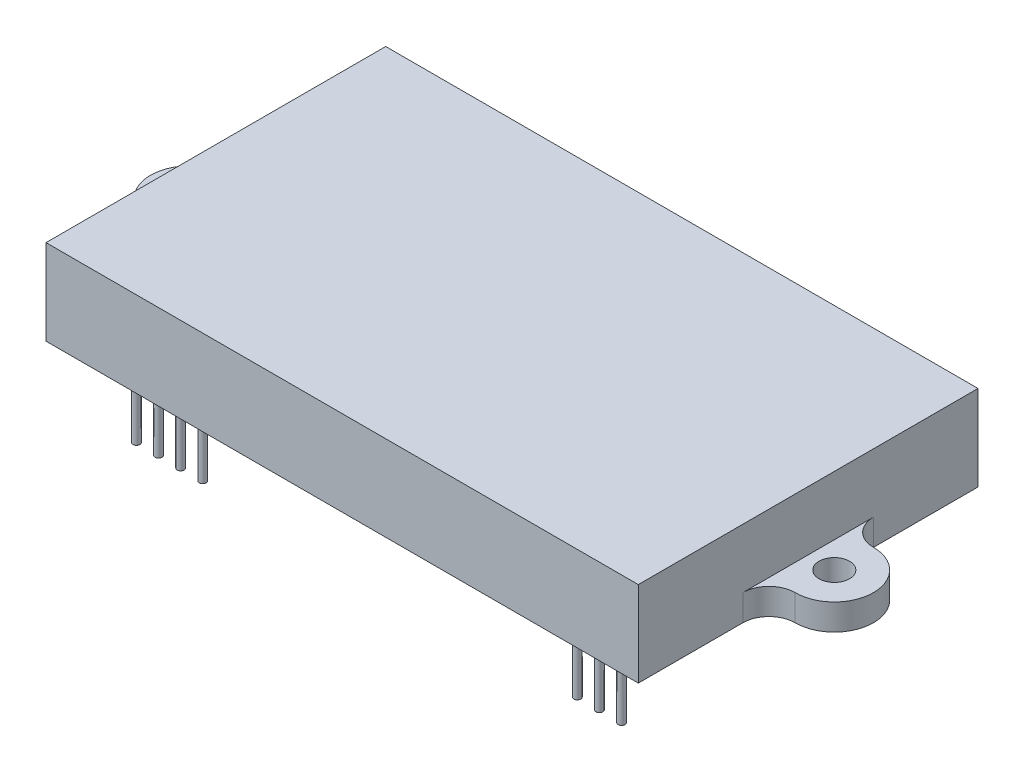
from build123d import *

# Parameters (mm, degrees)
ESQUISSE1_W        = 68
ESQUISSE1_H        = 39
BOSS_EXTRU_3_DEPTH = 9.8
ESQUISSE5_R        = 1.75
BOSS_EXTRU_5_DEPTH = 3
ESQUISSE6_R        = 1.75
BOSS_EXTRU_6_DEPTH = 3
ESQUISSE7_R        = 0.4
BOSS_EXTRU_7_DEPTH = 8.9
CONG_1_R           = 0.02


with BuildPart() as part:
    # Esquisse1 → Boss.-Extru.3 (new body)
    with BuildSketch(Plane(origin=(0, 0, 0), x_dir=(1, 0, 0), z_dir=(0, 1, 0))):
        with Locations((34, 19.5)):
            Rectangle(ESQUISSE1_W, ESQUISSE1_H)
    extrude(amount=BOSS_EXTRU_3_DEPTH)

    # Esquisse5 → Boss.-Extru.5 (add)
    with BuildSketch(Plane(origin=(0, 0, 0), x_dir=(1, 0, 0), z_dir=(0, 1, 0))):
        with BuildLine():
            Line((0, 27), (0, 12))
            ThreePointArc((0, 12), (-0.878679656, 14.121320344), (-3, 15))
            ThreePointArc((-3, 15), (-7.5, 19.5), (-3, 24))
            ThreePointArc((-3, 24), (-0.878679656, 24.878679656), (0, 27))
        make_face()
        with Locations(Location((-3, 19.5, 0), (0, 0, 270))):
            Circle(ESQUISSE5_R, mode=Mode.SUBTRACT)
    extrude(amount=BOSS_EXTRU_5_DEPTH)

    # Esquisse6 → Boss.-Extru.6 (add)
    with BuildSketch(Plane(origin=(0, 0, 0), x_dir=(1, 0, 0), z_dir=(0, 1, 0))):
        with BuildLine():
            Line((68, 12), (68, 27))
            ThreePointArc((68, 27), (68.878679656, 24.878679656), (71, 24))
            ThreePointArc((71, 24), (75.5, 19.5), (71, 15))
            ThreePointArc((71, 15), (68.878679656, 14.121320344), (68, 12))
        make_face()
        with Locations(Location((71, 19.5, 0), (0, 0, 270))):
            Circle(ESQUISSE6_R, mode=Mode.SUBTRACT)
    extrude(amount=BOSS_EXTRU_6_DEPTH)

    # Esquisse7 → Boss.-Extru.7 (add)
    with BuildSketch(Plane(origin=(0, 0, 0), x_dir=(1, 0, 0), z_dir=(0, 1, 0))):
        with Locations(Location((14, 4, 0), (0, 0, 270))):
            Circle(ESQUISSE7_R)
        with Locations(Location((11.46, 4, 0), (0, 0, 270))):
            Circle(ESQUISSE7_R)
        with Locations(Location((8.92, 4, 0), (0, 0, 270))):
            Circle(ESQUISSE7_R)
        with Locations(Location((6.38, 4, 0), (0, 0, 270))):
            Circle(ESQUISSE7_R)
        with Locations(Location((57, 4, 0), (0, 0, 270))):
            Circle(ESQUISSE7_R)
        with Locations(Location((59.54, 4, 0), (0, 0, 270))):
            Circle(ESQUISSE7_R)
        with Locations(Location((62.08, 4, 0), (0, 0, 270))):
            Circle(ESQUISSE7_R)
    extrude(amount=-BOSS_EXTRU_7_DEPTH)

    # Congé1
    cong_1_edges = [part.edges().sort_by_distance(p)[0] for p in [
        (14, -8.9, -4.4),
        (57, -8.9, -4.4),
        (11.46, -8.9, -4.4),
        (8.92, -8.9, -4.4),
        (6.38, -8.9, -4.4),
        (59.54, -8.9, -4.4),
        (62.08, -8.9, -4.4),
    ]]
    fillet(cong_1_edges, radius=CONG_1_R)


solid = part.part
